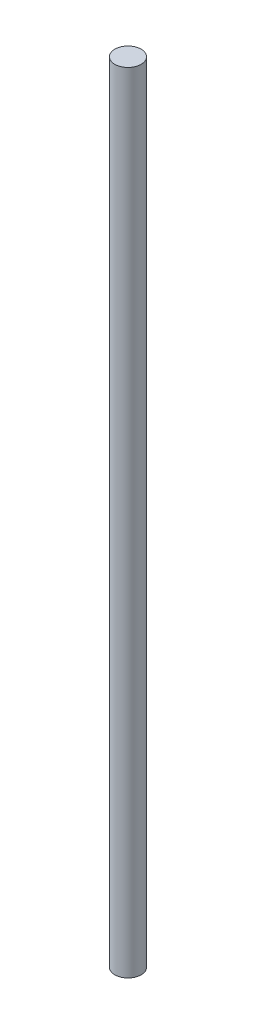
from build123d import *

# Parameters (mm, degrees)
SKETCH7_R           = 20
BOSS_EXTRUDE6_DEPTH = 1200


with BuildPart() as part:
    # Sketch7 → Boss-Extrude6 (new body)
    with BuildSketch(Plane(origin=(6.787074037, 0, -8.53976463), x_dir=(1, 0, 0), z_dir=(0, 1, 0))):
        with Locations(Location((-57.469535774, -38.392511451, 0), (0, 0, 270))):
            Circle(SKETCH7_R)
    extrude(amount=BOSS_EXTRUDE6_DEPTH)


solid = part.part
